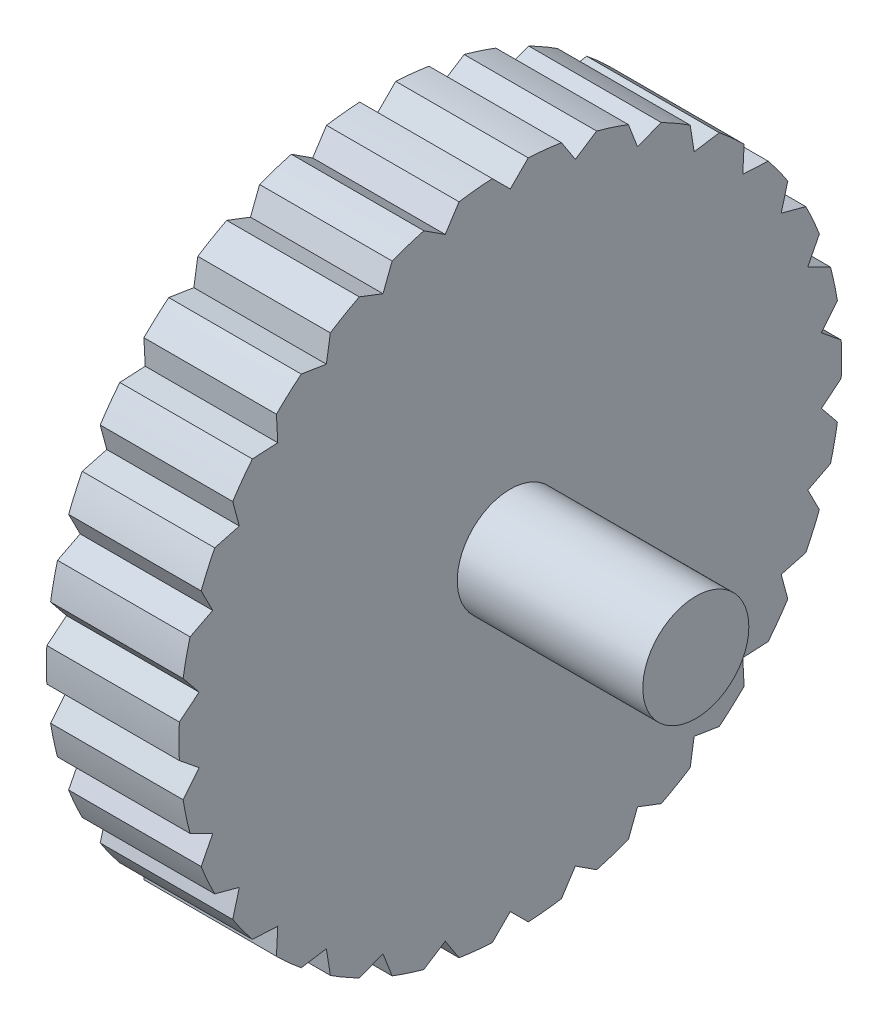
from build123d import *

# Parameters (mm, degrees)
SKETCH1_R           = 5.08
BOSS_EXTRUDE1_DEPTH = 17.78
SKETCH2_R           = 31.75
BOSS_EXTRUDE2_DEPTH = 12.7
CUT_EXTRUDE2_DEPTH  = 49.293409488
CIRPATTERN2_COUNT   = 30


with BuildPart() as part:
    # Sketch1 → Boss-Extrude1 (new body)
    with BuildSketch(Plane(origin=(0, 0, 0), x_dir=(0, 0, -1), z_dir=(1, 0, 0))):
        Circle(SKETCH1_R)
    extrude(amount=BOSS_EXTRUDE1_DEPTH)

    # Sketch2 → Boss-Extrude2 (add)
    with BuildSketch(Plane.ZY):
        Circle(SKETCH2_R)
    extrude(amount=BOSS_EXTRUDE2_DEPTH)

    # Sketch5 → Cut-Extrude2 (cut, through all)
    with BuildSketch(Plane(origin=(0, 0, 0), x_dir=(0, 0, -1), z_dir=(1, 0, 0))):
        with BuildLine():
            Line((0, 29.980101005), (1.723107067, 31.703208072))
            ThreePointArc((1.723107067, 31.703208072), (0, 31.75), (-1.723107067, 31.703208072))
            Line((-1.723107067, 31.703208072), (0, 29.980101005))
        make_face()
    cut_extrude2 = extrude(amount=-CUT_EXTRUDE2_DEPTH, mode=Mode.SUBTRACT)

    # CirPattern2: Cut-Extrude2 ×30 about axis
    cirpattern2_axis = Axis((0, 0, 0), (1, 0, 0))
    for i in range(1, CIRPATTERN2_COUNT):
        add(cut_extrude2.rotate(cirpattern2_axis, i * 360 / CIRPATTERN2_COUNT), mode=Mode.SUBTRACT)


solid = part.part
